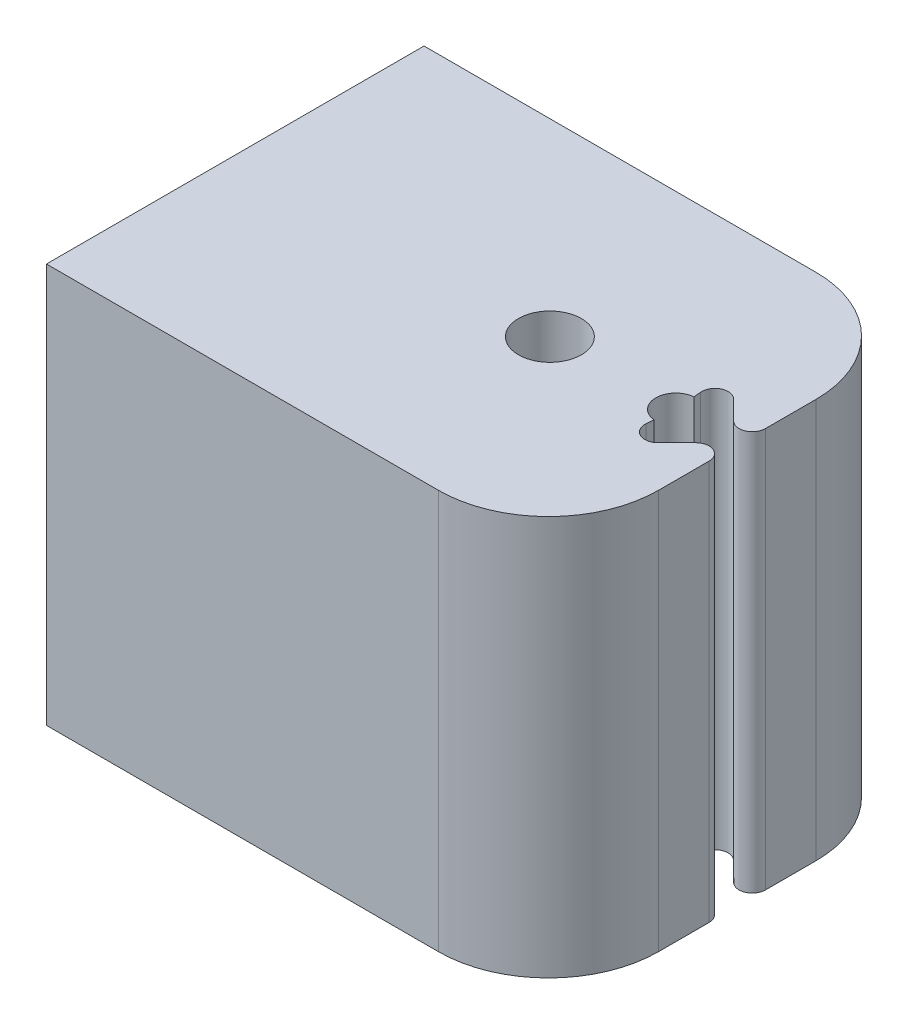
from build123d import *

# Parameters (mm, degrees)
SKETCH1_R           = 1
BOSS_EXTRUDE1_DEPTH = 12.7
SKETCH2_R           = 4
CUT_EXTRUDE1_DEPTH  = 10


with BuildPart() as part:
    # Sketch1 → Boss-Extrude1 (new body)
    with BuildSketch(Plane(origin=(0, 0, 0), x_dir=(1, 0, 0), z_dir=(0, 1, 0))):
        with BuildLine():
            Line((-4.055343897, 0.632583633), (-4.075844459, 0.866906139))
            ThreePointArc((-4.075844459, 0.866906139), (-3.83530083, 1.283539926), (-3.361522369, 1.2))
            Line((-3.361522369, 1.2), (-2.761522369, 0.6))
            ThreePointArc((-2.761522369, 0.6), (-2.304491577, 0.509090923), (-2.04560443, 0.89654292))
            Line((-2.04560443, 0.89654292), (-2.04560443, 2.5))
            ThreePointArc((-2.04560443, 2.5), (-3.070730696, 4.974873734), (-5.54560443, 6))
            Line((-5.54560443, 6), (-18, 6))
            Line((-18, 6), (-18, -6))
            Line((-18, -6), (-5.54560443, -6))
            ThreePointArc((-5.54560443, -6), (-3.070730696, -4.974873734), (-2.04560443, -2.5))
            Line((-2.04560443, -2.5), (-2.04560443, -0.89654292))
            ThreePointArc((-2.04560443, -0.89654292), (-2.304491577, -0.509090923), (-2.761522369, -0.6))
            Line((-2.761522369, -0.6), (-3.361522369, -1.2))
            ThreePointArc((-3.361522369, -1.2), (-3.83530083, -1.283539926), (-4.075844459, -0.866906139))
            Line((-4.075844459, -0.866906139), (-4.055343897, -0.632583633))
            ThreePointArc((-4.055343897, -0.632583633), (-4.635, 0), (-4.055343897, 0.632583633))
        make_face()
        with Locations(Location((-8, 0, 0), (0, 0, 270))):
            Circle(SKETCH1_R, mode=Mode.SUBTRACT)
    extrude(amount=BOSS_EXTRUDE1_DEPTH)

    # Sketch2 → Cut-Extrude1 (cut)
    with BuildSketch(Plane.ZY.offset(18)):
        with Locations((0, 6.35)):
            Circle(SKETCH2_R)
    extrude(amount=-CUT_EXTRUDE1_DEPTH, mode=Mode.SUBTRACT)


solid = part.part
